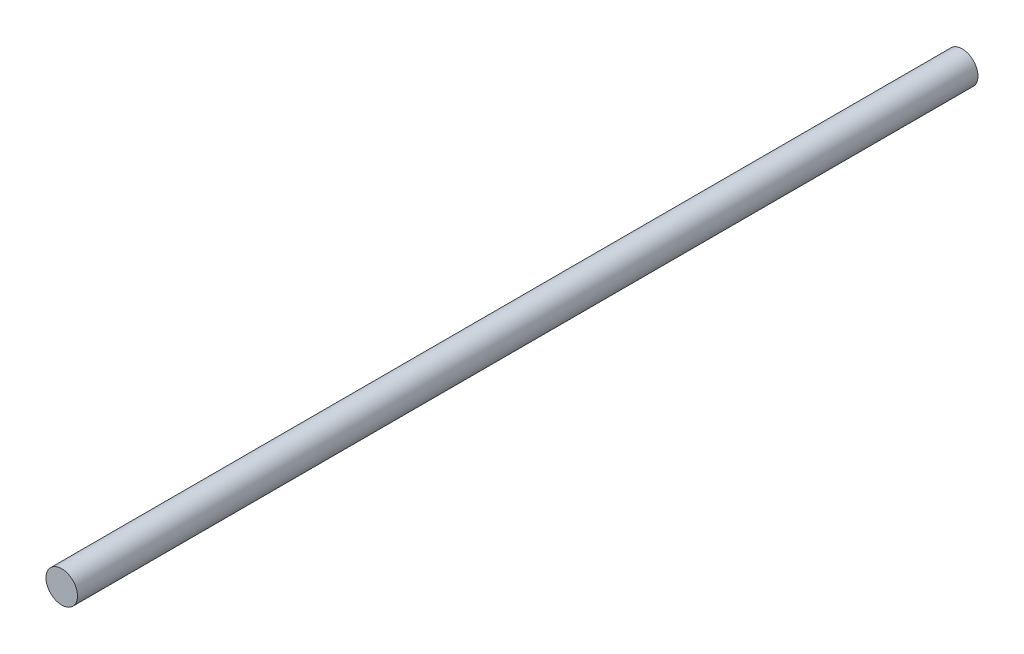
from build123d import *

# Parameters (mm, degrees)
SKETCH1_R           = 0.7
BOSS_EXTRUDE1_DEPTH = 40


with BuildPart() as part:
    # Sketch1 → Boss-Extrude1 (new body)
    with BuildSketch(Plane.XY):
        Circle(SKETCH1_R)
    extrude(amount=BOSS_EXTRUDE1_DEPTH)


solid = part.part
